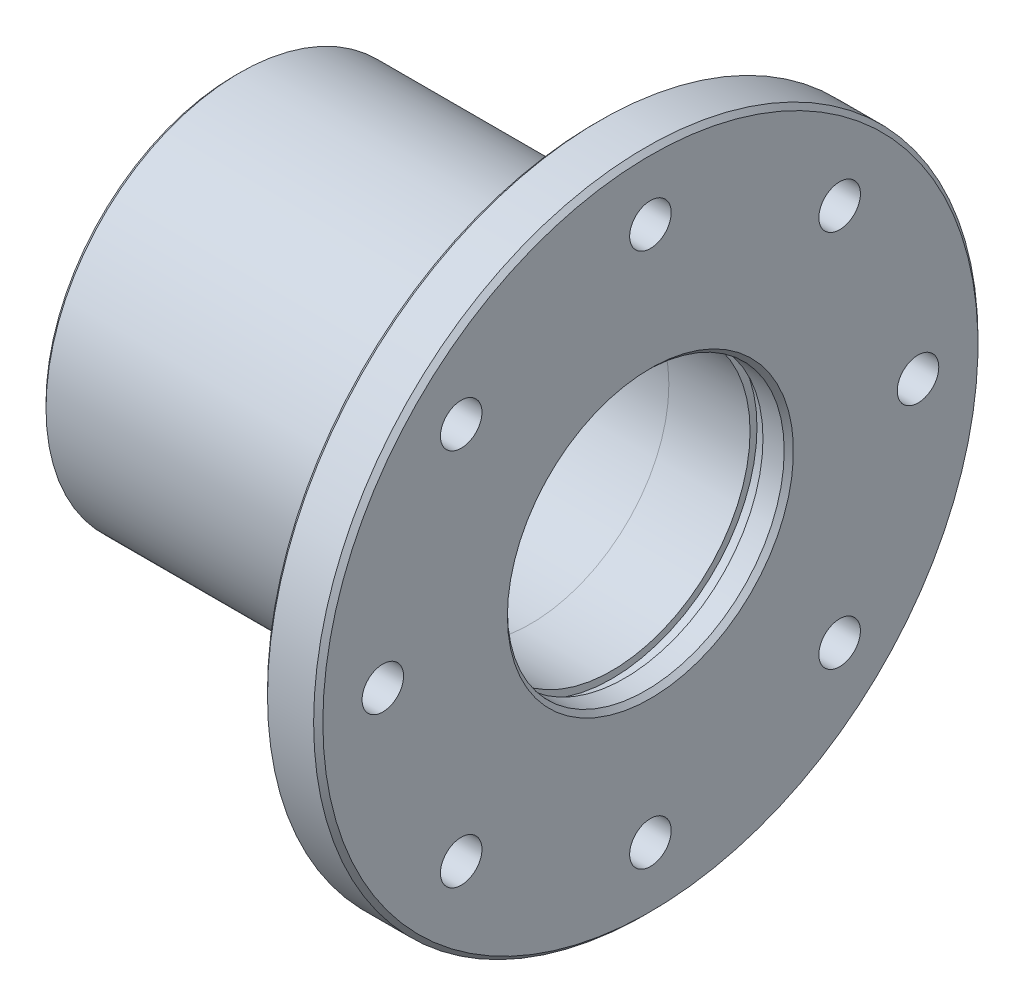
from build123d import *

# Parameters (mm, degrees)
M4_GEWINDEBOHRUNG1_D            = 3.3
M4_GEWINDEBOHRUNG1_DEPTH        = 13
M4_GEWINDEBOHRUNG1_TIP          = 0.991420021
SKIZZE8_R                       = 2.25
SCHNITT_LINEAR_AUSTRAGEN1_DEPTH = 68.948509917


with BuildPart() as part:
    # Skizze2 → Rotation1 (revolve)
    with BuildSketch(Plane(origin=(0, 0, 0), x_dir=(1, 0, 0), z_dir=(0, 1, 0)), mode=Mode.PRIVATE) as rotation1_sk:
        with BuildLine():
            Line((33.5, 21.002136322), (33.5, 15))
            Line((33.5, 15), (40.8, 15))
            Line((40.8, 15), (40.8, 15.75))
            Line((40.8, 15.75), (42.2, 15.75))
            Line((42.2, 15.75), (42.2, 15))
            Line((42.2, 15), (44.5, 15))
            Line((44.5, 15), (45, 15.5))
            Line((45, 15.5), (45, 20))
            Line((45, 20), (45, 35.5))
            Line((45, 35.5), (44.5, 36))
            Line((44.5, 36), (39.5, 36))
            Line((39.5, 36), (39, 35.5))
            Line((39, 35.5), (39, 21.502136322))
            ThreePointArc((39, 21.502136322), (38.853553391, 21.148582931), (38.5, 21.002136322))
            Line((38.5, 21.002136322), (33.5, 21.002136322))
        make_face()
        Polygon((0, 20.502136322), (0, 15.5), (0.5, 15), (2.8, 15), (2.8, 15.75), (4.2, 15.75), (4.2, 15), (33.5, 15), (33.5, 21.002136322), (0.5, 21.002136322), align=None)
    revolve(rotation1_sk.sketch.rotate(Axis((0, 0, 0), (1, 0, 0)), 180), axis=Axis((0, 0, 0), (1, 0, 0)))

    # M4 Gewindebohrung1
    with Locations(Plane(origin=(67, 14.142135624, 14.142135624), x_dir=(0, 0, 1), z_dir=(1, 0, 0))):
        with Locations((0, 0), (-14.142135624, -5.857864376), (-28.284271248, 0), (-34.142135624, 14.142135624), (-28.284271248, 28.284271248), (-14.142135624, 34.142135624), (0, 28.284271248), (5.857864376, 14.142135624)):
            Hole(M4_GEWINDEBOHRUNG1_D / 2, depth=M4_GEWINDEBOHRUNG1_DEPTH)
            with Locations((0, 0, -(M4_GEWINDEBOHRUNG1_DEPTH + M4_GEWINDEBOHRUNG1_TIP / 2))):  # 118° drill point
                Cone(0, M4_GEWINDEBOHRUNG1_D / 2, M4_GEWINDEBOHRUNG1_TIP, mode=Mode.SUBTRACT)

    # Skizze8 → Schnitt-Linear austragen1 (cut, through all)
    with BuildSketch(Plane(origin=(45, 0, 0), x_dir=(0, 0, -1), z_dir=(1, 0, 0))):
        with Locations((0, 29)):
            Circle(SKIZZE8_R)
        with Locations((20.506096654, 20.506096654)):
            Circle(SKIZZE8_R)
        with Locations((29, 0)):
            Circle(SKIZZE8_R)
        with Locations((20.506096654, -20.506096654)):
            Circle(SKIZZE8_R)
        with Locations((0, -29)):
            Circle(SKIZZE8_R)
        with Locations((-20.506096654, -20.506096654)):
            Circle(SKIZZE8_R)
        with Locations((-29, 0)):
            Circle(SKIZZE8_R)
        with Locations((-20.506096654, 20.506096654)):
            Circle(SKIZZE8_R)
    extrude(amount=-SCHNITT_LINEAR_AUSTRAGEN1_DEPTH, mode=Mode.SUBTRACT)


solid = part.part
